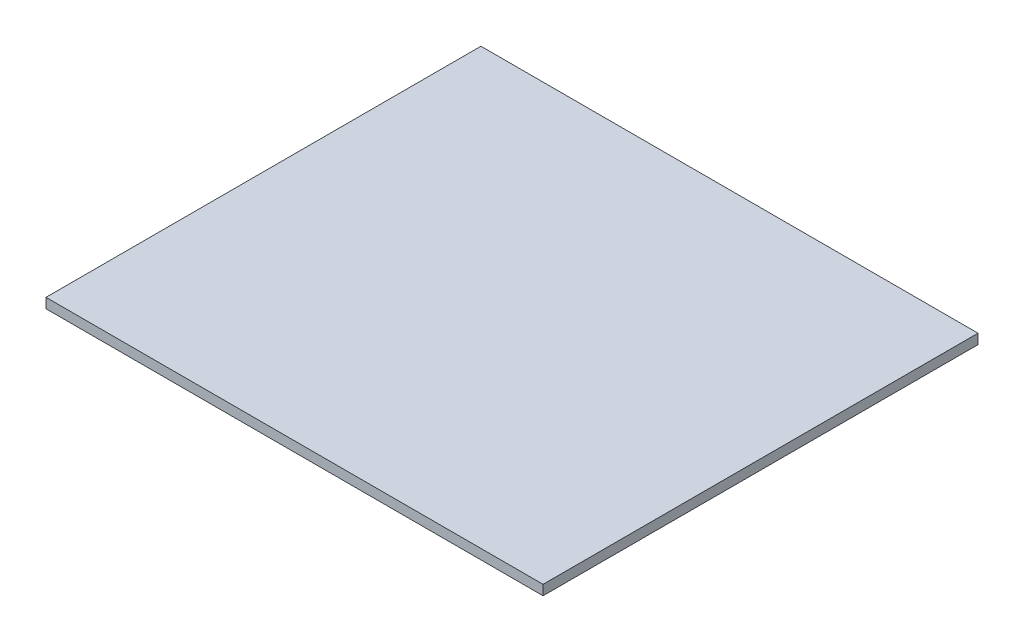
from build123d import *

# Parameters (mm, degrees)
SKETCH1_W           = 80
SKETCH1_H           = 70
BOSS_EXTRUDE1_DEPTH = 1.6


with BuildPart() as part:
    # Sketch1 → Boss-Extrude1 (new body)
    with BuildSketch(Plane(origin=(0, 0, 0), x_dir=(1, 0, 0), z_dir=(0, 1, 0))):
        with Locations((40, 35)):
            Rectangle(SKETCH1_W, SKETCH1_H)
    extrude(amount=BOSS_EXTRUDE1_DEPTH)


solid = part.part
